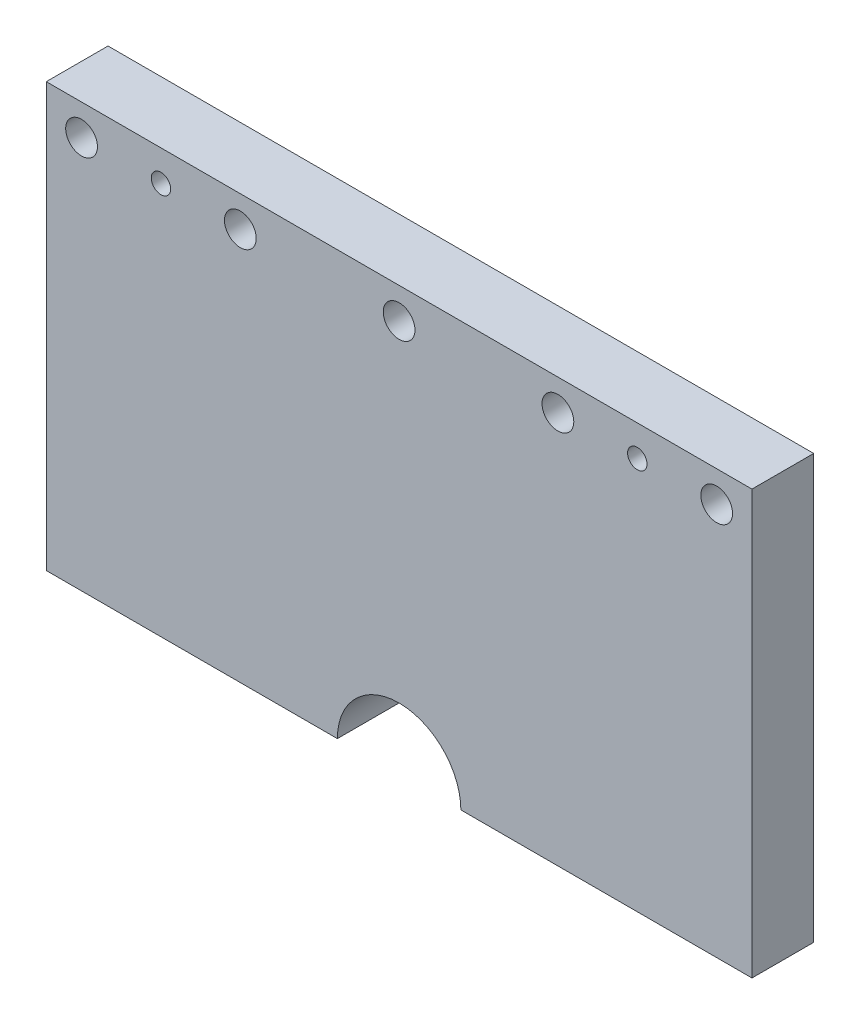
from build123d import *

# Parameters (mm, degrees)
ESBO_O1_W                                            = 400
ESBO_O1_H                                            = 240
RESSALTO_EXTRUS_O1_DEPTH                             = 35
ESBO_O2_R                                            = 35
CORTE_EXTRUS_O1_DEPTH                                = 315.364438192
FURO_ROSCADO_DE_M101_D                               = 8.5
FURO_ROSCADO_DE_M101_DEPTH                           = 27.5
FURO_ROSCADO_DE_M101_TIP                             = 2.553657631
FUROS_GUIA_COM_10_0MM1_D                             = 10
FUROS_GUIA_COM_10_0MM1_DEPTH                         = 27.5
FUROS_GUIA_COM_10_0MM1_TIP                           = 3.004303095
REBAIXO_PARA_PARAFUSO_ALLEN_SEXTAVADO_DE_D           = 11
REBAIXO_PARA_PARAFUSO_ALLEN_SEXTAVADO_DE_CBORE_D     = 18
REBAIXO_PARA_PARAFUSO_ALLEN_SEXTAVADO_DE_CBORE_DEPTH = 15
FUROS_GUIA_COM_10_0MM2_D                             = 10
FURO_DE_DI_METRO_11_0_11_1_D                         = 11
FURO_DE_DI_METRO_11_0_11_1_DEPTH                     = 15
FURO_DE_DI_METRO_11_0_11_1_TIP                       = 3.304733405


with BuildPart() as part:
    # Esboço1 → Ressalto-extrusão1 (new body)
    with BuildSketch(Plane.XY):
        with Locations((0, -120)):
            Rectangle(ESBO_O1_W, ESBO_O1_H)
    extrude(amount=RESSALTO_EXTRUS_O1_DEPTH)

    # Esboço2 → Corte-extrusão1 (cut, through all)
    with BuildSketch(Plane(origin=(0, 0, 0), x_dir=(-1, 0, 0), z_dir=(0, 0, -1))):
        with Locations((0, -240)):
            Circle(ESBO_O2_R)
    extrude(amount=-CORTE_EXTRUS_O1_DEPTH, mode=Mode.SUBTRACT)

    # Furo roscado de M101
    with Locations(Plane(origin=(0, -240, 0), x_dir=(-1, 0, 0), z_dir=(0, -1, 0))):
        with Locations((-180, -17.5), (-80, -17.5), (80, -17.5), (180, -17.5)):
            Hole(FURO_ROSCADO_DE_M101_D / 2, depth=FURO_ROSCADO_DE_M101_DEPTH)
            with Locations((0, 0, -(FURO_ROSCADO_DE_M101_DEPTH + FURO_ROSCADO_DE_M101_TIP / 2))):  # 118° drill point
                Cone(0, FURO_ROSCADO_DE_M101_D / 2, FURO_ROSCADO_DE_M101_TIP, mode=Mode.SUBTRACT)

    # Furos-guia com Ø10.0mm1
    with Locations(Plane(origin=(0, -240, 0), x_dir=(-1, 0, 0), z_dir=(0, -1, 0))):
        with Locations((-130, -17.5), (130, -17.5)):
            Hole(FUROS_GUIA_COM_10_0MM1_D / 2, depth=FUROS_GUIA_COM_10_0MM1_DEPTH)
            with Locations((0, 0, -(FUROS_GUIA_COM_10_0MM1_DEPTH + FUROS_GUIA_COM_10_0MM1_TIP / 2))):  # 118° drill point
                Cone(0, FUROS_GUIA_COM_10_0MM1_D / 2, FUROS_GUIA_COM_10_0MM1_TIP, mode=Mode.SUBTRACT)

    # Rebaixo para parafuso Allen sextavado de M101 (through all)
    with Locations(Plane.XY.offset(35)):
        with Locations((180, -17.5), (90, -17.5), (0, -17.5), (-90, -17.5), (-180, -17.5)):
            CounterBoreHole(REBAIXO_PARA_PARAFUSO_ALLEN_SEXTAVADO_DE_D / 2, REBAIXO_PARA_PARAFUSO_ALLEN_SEXTAVADO_DE_CBORE_D / 2, REBAIXO_PARA_PARAFUSO_ALLEN_SEXTAVADO_DE_CBORE_DEPTH)

    # Furos-guia com Ø10.0mm2 (through all)
    with Locations(Plane.XY.offset(35)):
        with Locations((135, -17.5), (-135, -17.5)):
            Hole(FUROS_GUIA_COM_10_0MM2_D / 2)

    # Furo de diâmetro Ø11.0 (11)1
    with Locations(Plane.XY.offset(35)):
        with Locations((135, -17.5), (-135, -17.5)):
            Hole(FURO_DE_DI_METRO_11_0_11_1_D / 2, depth=FURO_DE_DI_METRO_11_0_11_1_DEPTH)
            with Locations((0, 0, -(FURO_DE_DI_METRO_11_0_11_1_DEPTH + FURO_DE_DI_METRO_11_0_11_1_TIP / 2))):  # 118° drill point
                Cone(0, FURO_DE_DI_METRO_11_0_11_1_D / 2, FURO_DE_DI_METRO_11_0_11_1_TIP, mode=Mode.SUBTRACT)


solid = part.part
